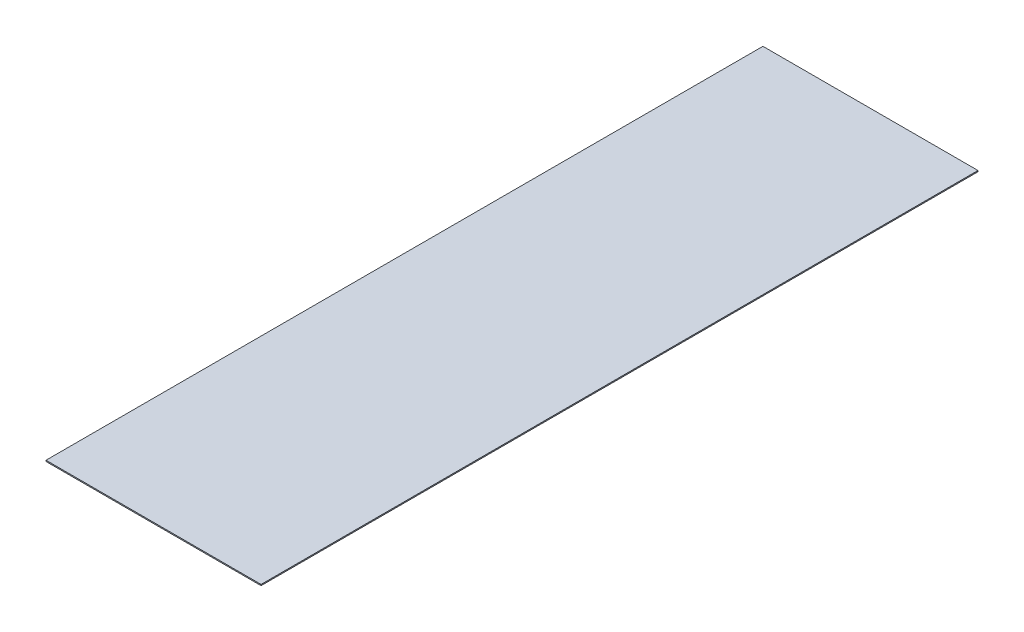
from build123d import *

# Parameters (mm, degrees)
CROQUIS1_W              = 914.4
CROQUIS1_H              = 3048
SALIENTE_EXTRUIR1_DEPTH = 4.8


with BuildPart() as part:
    # Croquis1 → Saliente-Extruir1 (new body)
    with BuildSketch(Plane(origin=(0, 0, 0), x_dir=(1, 0, 0), z_dir=(0, 1, 0))):
        Rectangle(CROQUIS1_W, CROQUIS1_H)
    extrude(amount=SALIENTE_EXTRUIR1_DEPTH)


solid = part.part
